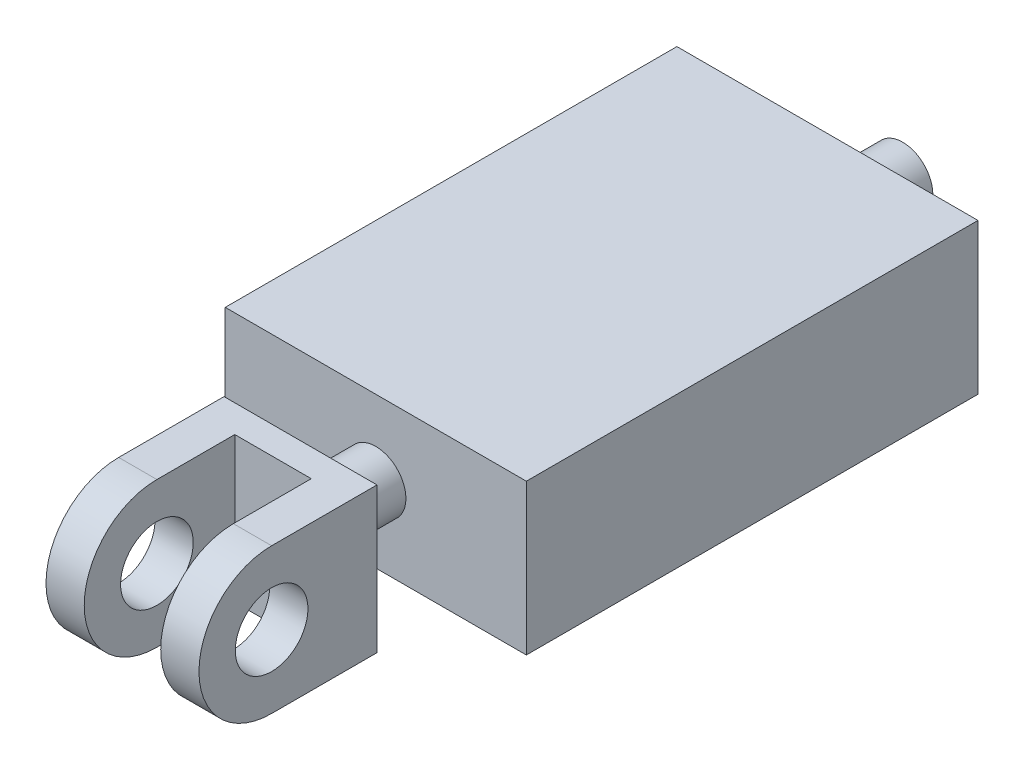
from build123d import *

# Parameters (mm, degrees)
SKETCH1_W                = 20
SKETCH1_H                = 30
BOSS_EXTRUDE1_DEPTH      = 10
BOSS_EXTRUDE2_DEPTH      = 20
BOSS_EXTRUDE2_DEPTH_BACK = 20
SKETCH2_R                = 2
BOSS_EXTRUDE3_DEPTH      = 5.08
BOSS_EXTRUDE3_DEPTH_BACK = 5.08
SKETCH4_R                = 2.413
SKETCH5_W                = 5.08
SKETCH5_H                = 10
CUT_EXTRUDE1_DEPTH       = 35.777069342


with BuildPart() as part:
    # Sketch1 → Boss-Extrude1 (new body)
    with BuildSketch(Plane(origin=(0, 0, 0), x_dir=(1, 0, 0), z_dir=(0, 1, 0))):
        Rectangle(SKETCH1_W, SKETCH1_H)
    extrude(amount=BOSS_EXTRUDE1_DEPTH)

    # Sketch2 → Boss-Extrude2 (add, two sides: drawn at the far end of the back side and taken through both)
    with BuildSketch(Plane.XY.offset(-BOSS_EXTRUDE2_DEPTH_BACK)):
        with Locations((0, 5)):
            Circle(SKETCH2_R)
    extrude(amount=BOSS_EXTRUDE2_DEPTH + BOSS_EXTRUDE2_DEPTH_BACK)

    # Sketch4 → Boss-Extrude3 (add, two sides: drawn at the far end of the back side and taken through both)
    with BuildSketch(Plane(origin=(0, 0, 0), x_dir=(0, 0, -1), z_dir=(1, 0, 0)).offset(-BOSS_EXTRUDE3_DEPTH_BACK)):
        with BuildLine():
            Line((-27, 9.826), (-20, 9.826))
            Line((-20, 9.826), (-20, 0.174))
            Line((-20, 0.174), (-27, 0.174))
            ThreePointArc((-27, 0.174), (-31.826, 5), (-27, 9.826))
        make_face()
        with Locations((-27, 5)):
            Circle(SKETCH4_R, mode=Mode.SUBTRACT)
    extrude(amount=BOSS_EXTRUDE3_DEPTH + BOSS_EXTRUDE3_DEPTH_BACK)

    # Sketch5 → Cut-Extrude1 (cut, through all)
    with BuildSketch(Plane(origin=(0, 9.826, 0), x_dir=(1, 0, 0), z_dir=(0, 1, 0))):
        with Locations((0, -26.826)):
            Rectangle(SKETCH5_W, SKETCH5_H)
    extrude(amount=-CUT_EXTRUDE1_DEPTH, mode=Mode.SUBTRACT)


solid = part.part
